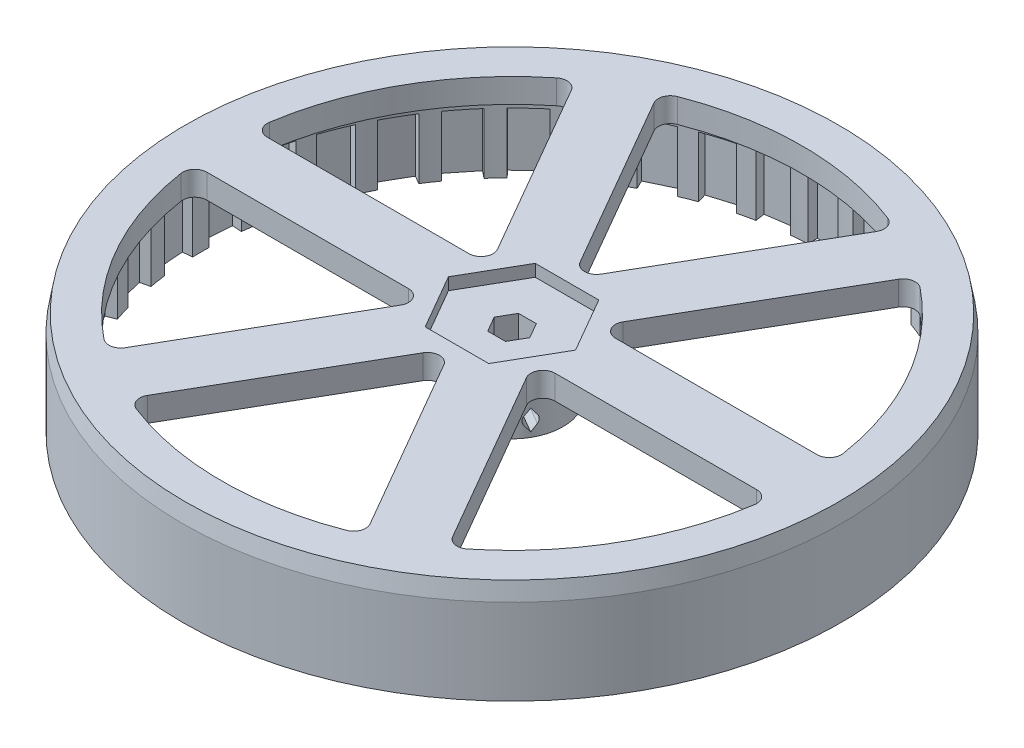
from build123d import *

# Parameters (mm, degrees)
SLOT_CUT_DEPTH                 = 79.92718163
SLOT_CUT_PATTERN_COUNT         = 6
MAGNET_START                   = -10
MAGNET_SLOTS_DEPTH             = 10
MAGNET_CUT_PATTERN_COUNT       = 42
CHAMFER1_SIZE                  = 0.5
CHAMFER1_SIZE2                 = 2.83564091
CUT_EXTRUDE1_DEPTH             = 79.92718163
CUT_EXTRUDE1_DEPTH_BACK        = 79.92718163
SKETCH8_R                      = 8.45
BOSS_EXTRUDE1_DEPTH            = 8
SKETCH9_R                      = 8.95
SKETCH9_R_2                    = 8.45
BOSS_EXTRUDE2_DEPTH            = 1
CUT_EXTRUDE2_DEPTH             = 1.6
CUT_EXTRUDE2_DEPTH_BACK        = 1.6
SKETCH10_W                     = 4
SKETCH10_H                     = 5
CUT_EXTRUDE3_DEPTH             = 1.6
CUT_EXTRUDE3_DEPTH_BACK        = 1.6
CUT_EXTRUDE3_START             = 5.1
SKETCH10_2_W                   = 4
SKETCH10_2_H                   = 5
FILLET1_R                      = 0.5
CUT_EXTRUDE4_REACH             = 89.548
CUT_EXTRUDE4_DIRECTION_2_DEPTH = 15.5
CUT_EXTRUDE6_DEPTH             = 2


with BuildPart() as part:
    # Sketch1 → Main Revolve (revolve)
    with BuildSketch(Plane.XY, mode=Mode.PRIVATE) as main_revolve_sk:
        Polygon((0, 29), (0, 33), (54.5, 33), (54.5, 16), (51.5, 16), (51.5, 29), align=None)
    revolve(main_revolve_sk.sketch.rotate(Axis((0, 0, 0), (0, 1, 0)), 90), axis=Axis((0, 0, 0), (0, 1, 0)))

    # Sketch2 → Slot Cut (cut, through all)
    with BuildSketch(Plane(origin=(0, 33, 0), x_dir=(1, 0, 0), z_dir=(0, 1, 0))):
        with BuildLine():
            Line((18.402008824, 41.873214245), (1.732050808, 13))
            ThreePointArc((1.732050808, 13), (0, 12), (-1.732050808, 13))
            Line((-1.732050808, 13), (-18.402008824, 41.873214245))
            ThreePointArc((-18.402008824, 41.873214245), (-18.556676058, 43.536761555), (-17.3947388, 44.737267038))
            ThreePointArc((-17.3947388, 44.737267038), (0, 48), (17.3947388, 44.737267038))
            ThreePointArc((17.3947388, 44.737267038), (18.556676058, 43.536761555), (18.402008824, 41.873214245))
        make_face()
    slot_cut = extrude(amount=-SLOT_CUT_DEPTH, mode=Mode.SUBTRACT)

    # Slot Cut Pattern: Slot Cut ×6 about axis
    slot_cut_pattern_axis = Axis((0, 0, 0), (0, 1, 0))
    for i in range(1, SLOT_CUT_PATTERN_COUNT):
        add(slot_cut.rotate(slot_cut_pattern_axis, i * 360 / SLOT_CUT_PATTERN_COUNT), mode=Mode.SUBTRACT)

    # Sketch4 → Magnet Slots (cut)
    with BuildSketch(Plane.XZ.offset(-16).offset(MAGNET_START)):
        with BuildLine():
            Line((-2.5, 53), (2.5, 53))
            Line((2.5, 53), (2.5, 51.439284598))
            ThreePointArc((2.5, 51.439284598), (0, 51.5), (-2.5, 51.439284598))
            Line((-2.5, 51.439284598), (-2.5, 53))
        make_face()
    magnet_slots = extrude(amount=MAGNET_SLOTS_DEPTH, mode=Mode.SUBTRACT)

    # Magnet Cut Pattern: Magnet Slots ×42 about axis
    magnet_cut_pattern_axis = Axis((0, 0, 0), (0, 1, 0))
    for i in range(1, MAGNET_CUT_PATTERN_COUNT):
        add(magnet_slots.rotate(magnet_cut_pattern_axis, i * 360 / MAGNET_CUT_PATTERN_COUNT), mode=Mode.SUBTRACT)

    # Chamfer1
    chamfer1_edges = [part.edges().sort_by_distance(p)[0] for p in [
        (0, 33, 54.5),
    ]]
    chamfer1_side = [part.faces().sort_by_distance(p)[0] for p in [
        (0, 33, 0),
    ]]
    chamfer(chamfer1_edges, length=CHAMFER1_SIZE, length2=CHAMFER1_SIZE2, reference=chamfer1_side[0])

    # Sketch5 → Cut-Extrude1 (cut, two sides: drawn at the far end of the back side and taken through both)
    with BuildSketch(Plane(origin=(0, 33, 0), x_dir=(1, 0, 0), z_dir=(0, 1, 0)).offset(-CUT_EXTRUDE1_DEPTH_BACK)):
        Polygon((2.944486373, 0), (1.472243186, 2.55), (-1.472243186, 2.55), (-2.944486373, 0), (-1.472243186, -2.55), (1.472243186, -2.55), align=None)
    extrude(amount=CUT_EXTRUDE1_DEPTH + CUT_EXTRUDE1_DEPTH_BACK, mode=Mode.SUBTRACT)

    # Sketch8 → Boss-Extrude1 (add)
    with BuildSketch(Plane.XZ.offset(-29)):
        with Locations(Location((0, 0, 0), (0, 0, 270))):
            Circle(SKETCH8_R)
        Polygon((2.944486373, 0), (1.472243186, 2.55), (-1.472243186, 2.55), (-2.944486373, 0), (-1.472243186, -2.55), (1.472243186, -2.55), align=None, mode=Mode.SUBTRACT)
    extrude(amount=BOSS_EXTRUDE1_DEPTH)

    # Sketch9 → Boss-Extrude2 (add)
    with BuildSketch(Plane.XZ.offset(-29)):
        with Locations(Location((0, 0, 0), (0, 0, 270))):
            Circle(SKETCH9_R)
        with Locations(Location((0, 0, 0), (0, 0, 270))):
            Circle(SKETCH9_R_2, mode=Mode.SUBTRACT)
    extrude(amount=BOSS_EXTRUDE2_DEPTH)

    # Sketch10 → Cut-Extrude2 (cut, two sides: drawn at the far end of the back side and taken through both)
    with BuildSketch(Plane(origin=(-2.20836478, 0, -1.275), x_dir=(0.4999999999999999, 0, -0.8660254037844387), z_dir=(0.8660254037844388, 0, 0.49999999999999994)).offset(-CUT_EXTRUDE2_DEPTH_BACK)):
        with Locations((0, 23.5)):
            Rectangle(SKETCH10_W, SKETCH10_H)
    extrude(amount=CUT_EXTRUDE2_DEPTH + CUT_EXTRUDE2_DEPTH_BACK, mode=Mode.SUBTRACT)

    # Sketch10<2> → Cut-Extrude3 (cut, two sides: drawn at the far end of the back side and taken through both)
    with BuildSketch(Plane(origin=(-2.20836478, 0, -1.275), x_dir=(0.4999999999999999, 0, -0.8660254037844387), z_dir=(0.8660254037844388, 0, 0.49999999999999994)).offset(CUT_EXTRUDE3_START - CUT_EXTRUDE3_DEPTH_BACK)):
        with Locations((0, 23.5)):
            Rectangle(SKETCH10_2_W, SKETCH10_2_H)
    extrude(amount=CUT_EXTRUDE3_DEPTH + CUT_EXTRUDE3_DEPTH_BACK, mode=Mode.SUBTRACT)

    # Fillet1
    fillet1_edges = [part.edges().sort_by_distance(p)[0] for p in [
        (-2.416729559, 23.5, 0.914101615),
        (-0.416729559, 23.5, -2.55),
        (2.416729559, 23.5, -0.914101615),
        (0.416729559, 23.5, 2.55),
    ]]
    fillet(fillet1_edges, radius=FILLET1_R)

    # Sketch11 → Cut-Extrude4 (cut, up to next)
    with BuildSketch(Plane(origin=(-3.594005426, 0, -2.075), x_dir=(0.4999999999999997, 0, -0.8660254037844388), z_dir=(0.8660254037844389, 0, 0.49999999999999983)), mode=Mode.PRIVATE) as cut_extrude4_sk1:
        with BuildLine():
            Line((0, 21.8), (-0.82577818, 22.851470588))
            ThreePointArc((-0.82577818, 22.851470588), (-1.05, 23.5), (-0.82577818, 24.148529412))
            Line((-0.82577818, 24.148529412), (0, 25.2))
            Line((0, 25.2), (0.82577818, 24.148529412))
            ThreePointArc((0.82577818, 24.148529412), (1.05, 23.5), (0.82577818, 22.851470588))
            Line((0.82577818, 22.851470588), (0, 21.8))
        make_face()
    cut_extrude4_tool1 = extrude(cut_extrude4_sk1.sketch, amount=-CUT_EXTRUDE4_REACH, mode=Mode.PRIVATE) & part.part
    add(cut_extrude4_tool1.solids().sort_by_distance((-3.594005, 23.5, -2.075))[0], mode=Mode.SUBTRACT)

    # Sketch11 → Cut-Extrude4 direction 2 (cut)
    with BuildSketch(Plane(origin=(-3.594005426, 0, -2.075), x_dir=(0.4999999999999997, 0, -0.8660254037844388), z_dir=(0.8660254037844389, 0, 0.49999999999999983))):
        with BuildLine():
            Line((0, 21.8), (-0.82577818, 22.851470588))
            ThreePointArc((-0.82577818, 22.851470588), (-1.05, 23.5), (-0.82577818, 24.148529412))
            Line((-0.82577818, 24.148529412), (0, 25.2))
            Line((0, 25.2), (0.82577818, 24.148529412))
            ThreePointArc((0.82577818, 24.148529412), (1.05, 23.5), (0.82577818, 22.851470588))
            Line((0.82577818, 22.851470588), (0, 21.8))
        make_face()
    extrude(amount=CUT_EXTRUDE4_DIRECTION_2_DEPTH, mode=Mode.SUBTRACT)

    # Sketch14 → Cut-Extrude6 (cut)
    with BuildSketch(Plane(origin=(0, 33, 0), x_dir=(1, 0, 0), z_dir=(0, 1, 0))):
        Polygon((5.25388745, -9.1), (10.507774899, 0), (5.25388745, 9.1), (-5.25388745, 9.1), (-10.507774899, 0), (-5.25388745, -9.1), align=None)
    extrude(amount=-CUT_EXTRUDE6_DEPTH, mode=Mode.SUBTRACT)


solid = part.part
